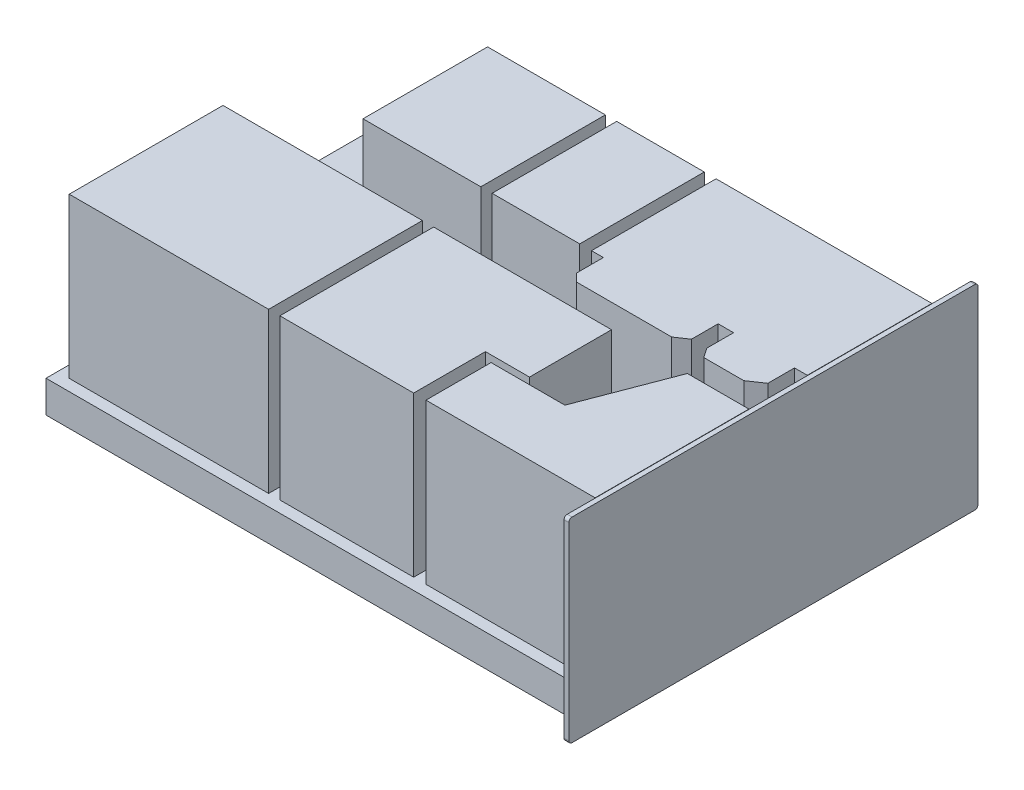
from build123d import *

# Parameters (mm, degrees)
SKETCH1_W           = 16.9901
SKETCH1_H           = 11.326733
BOSS_EXTRUDE1_DEPTH = 1
SKETCH2_W           = 12.826733
SKETCH2_H           = 6.1267257
BOSS_EXTRUDE2_DEPTH = 0.15
FILLET2_R           = 0.1
SKETCH3_W           = 6.250546152
SKETCH3_H           = 4.820472611
SKETCH3_W_2         = 2.746840533
SKETCH3_H_2         = 3.904582815
SKETCH3_W_3         = 3.692789168
BOSS_EXTRUDE3_DEPTH = 5
BOSS_EXTRUDE4_DEPTH = 2


with BuildPart() as part:
    # Sketch1 → Boss-Extrude1 (new body)
    with BuildSketch(Plane(origin=(0, 0, 0), x_dir=(1, 0, 0), z_dir=(0, 1, 0))):
        with Locations((8.49505, -5.6633665)):
            Rectangle(SKETCH1_W, SKETCH1_H)
    extrude(amount=BOSS_EXTRUDE1_DEPTH)

    # Sketch2 → Boss-Extrude2 (add)
    with BuildSketch(Plane(origin=(16.9901, 0, 0), x_dir=(0, 0, -1), z_dir=(1, 0, 0))):
        with Locations((-5.6633665, 3.06336285)):
            Rectangle(SKETCH2_W, SKETCH2_H)
    extrude(amount=BOSS_EXTRUDE2_DEPTH)

    # Fillet2
    fillet2_edges = [part.edges().sort_by_distance(p)[0] for p in [
        (17.0651, 6.1267257, 12.076733),
        (17.0651, 0, 12.076733),
        (17.0651, 0, -0.75),
        (17.0651, 6.1267257, -0.75),
    ]]
    fillet(fillet2_edges, radius=FILLET2_R)

    # Sketch3 → Boss-Extrude3 (add)
    with BuildSketch(Plane(origin=(0, 1, 0), x_dir=(1, 0, 0), z_dir=(0, 1, 0))):
        Polygon((6.971259917, -6.145413761), (12.546939904, -6.145413761), (12.546939904, -8.716332487), (11.165071089, -8.716332487), (11.165071089, -10.965886372), (6.971259917, -10.965886372), align=None)
        with Locations((3.492485517, -8.555650067)):
            Rectangle(SKETCH3_W, SKETCH3_H)
        Polygon((16.853228769, -6.145413761), (14.925039725, -6.145413761), (13.864535751, -8.925219633), (11.550708898, -8.925219633), (11.550708898, -10.965886372), (16.853228769, -10.965886372), align=None)
        Polygon((16.853228769, -0.409051354), (16.853228769, -4.313634169), (16.451522719, -4.313634169), (16.451522719, -5.149182755), (16.001611942, -5.454479354), (14.748289063, -5.454479354), (14.541123514, -5.149182755), (14.541123514, -4.313634169), (14.057354655, -4.313634169), (14.057354655, -5.149182755), (13.68878146, -5.399285995), (12.145233853, -5.399285995), (10.709853969, -5.399285995), (10.459750729, -5.149182755), (10.459750729, -4.313634169), (10.088036395, -4.313634169), (10.088036395, -0.409051354), align=None)
        with Locations((8.344680184, -2.361342761)):
            Rectangle(SKETCH3_W_2, SKETCH3_H_2)
        with Locations((4.771364009, -2.361342761)):
            Rectangle(SKETCH3_W_3, SKETCH3_H_2)
    extrude(amount=BOSS_EXTRUDE3_DEPTH)

    # Sketch4 → Boss-Extrude4 (add)
    with BuildSketch(Plane(origin=(0, 1, 0), x_dir=(1, 0, 0), z_dir=(0, 1, 0))):
        Polygon((0.367212441, -4.313634169), (0.367212441, -0.409051354), (1.636603562, -0.409051354), (2.664971052, -1.437418845), (2.664971052, -4.313634169), align=None)
    extrude(amount=BOSS_EXTRUDE4_DEPTH)


solid = part.part
